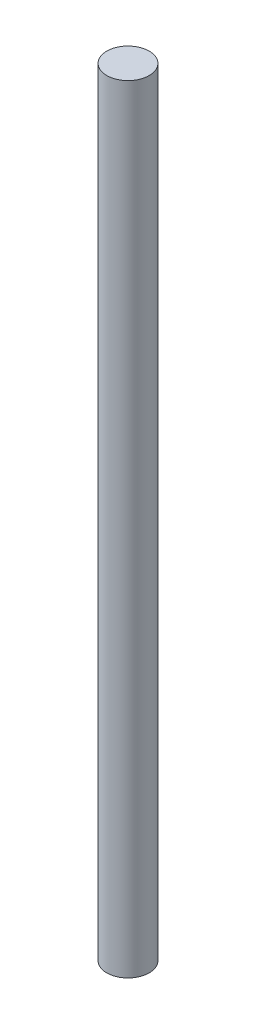
from build123d import *

# Parameters (mm, degrees)
CROQUIS1_R              = 3
SALIENTE_EXTRUIR1_DEPTH = 55


with BuildPart() as part:
    # Croquis1 → Saliente-Extruir1 (new, symmetric)
    with BuildSketch(Plane(origin=(0, 0, 0), x_dir=(1, 0, 0), z_dir=(0, 1, 0))):
        with Locations(Location((0, 0, 0), (0, 0, 270))):
            Circle(CROQUIS1_R)
    extrude(amount=SALIENTE_EXTRUIR1_DEPTH, both=True)


solid = part.part
